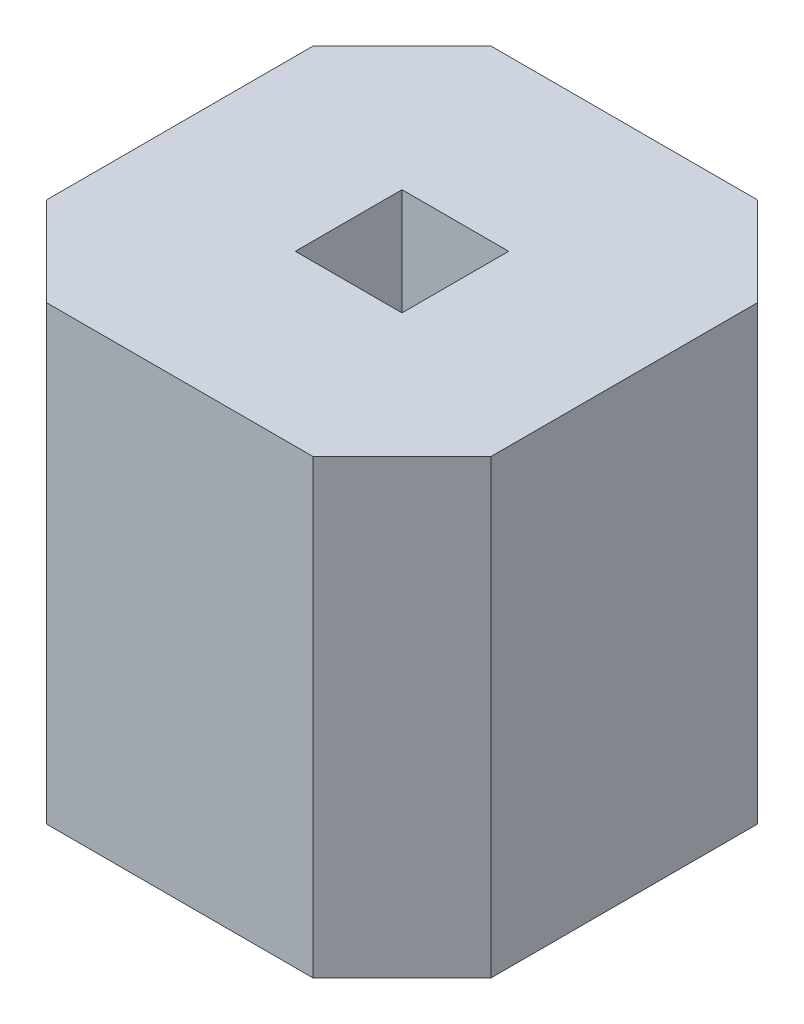
from build123d import *

# Parameters (mm, degrees)
SKETCH_1_W          = 2.5
SKETCH_1_H          = 2.5
EXTRUDE_1_DEPTH     = 2.54
CHAMFER_1_SIZE      = 0.5
SKETCH_2_W          = 0.6
SKETCH_2_H          = 0.6
CUT_EXTRUDE_1_DEPTH = 4.094608214


with BuildPart() as part:
    # 스케치1 → 보스-돌출1 (new body)
    with BuildSketch(Plane(origin=(0, 0, 0), x_dir=(1, 0, 0), z_dir=(0, 1, 0))):
        Rectangle(SKETCH_1_W, SKETCH_1_H)
    extrude(amount=EXTRUDE_1_DEPTH)

    # 모따기1
    chamfer_1_edges = [part.edges().sort_by_distance(p)[0] for p in [
        (-1.25, 1.27, 1.25),
        (-1.25, 1.27, -1.25),
        (1.25, 1.27, -1.25),
        (1.25, 1.27, 1.25),
    ]]
    chamfer(chamfer_1_edges, length=CHAMFER_1_SIZE)

    # 스케치2 → 컷-돌출1 (cut, through all)
    with BuildSketch(Plane(origin=(0, 2.54, 0), x_dir=(1, 0, 0), z_dir=(0, 1, 0))):
        Rectangle(SKETCH_2_W, SKETCH_2_H)
    extrude(amount=-CUT_EXTRUDE_1_DEPTH, mode=Mode.SUBTRACT)


solid = part.part
